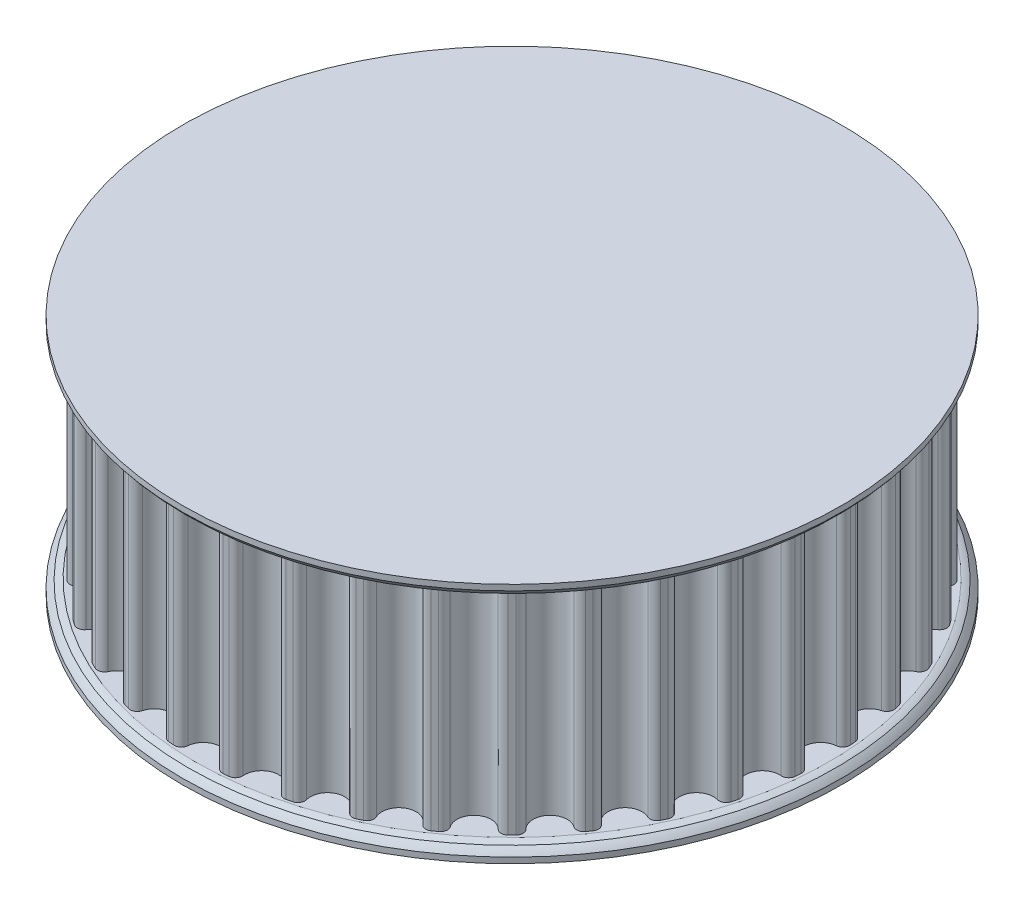
from build123d import *

# Parameters (mm, degrees)
SKETCH1_R               = 28.076389218
TOOTHOD_DEPTH           = 9.525
TOOTHPROFILE_DEPTH      = 45.039411475
TOOTHPATTERN_COUNT      = 36
LARGE_TOOTH_COUNT_DEPTH = 0.4


with BuildPart() as part:
    # Sketch1 → ToothOD (new, symmetric)
    with BuildSketch(Plane(origin=(0, 0, 0), x_dir=(1, 0, 0), z_dir=(0, 1, 0))):
        Circle(SKETCH1_R)
    extrude(amount=TOOTHOD_DEPTH, both=True)

    # Sketch2 → ToothProfile (cut, through all)
    with BuildSketch(Plane(origin=(0, 9.525, 0), x_dir=(1, 0, 0), z_dir=(0, 1, 0))):
        with BuildLine():
            ThreePointArc((-1.519425396, 27.411114635), (0, 26.016389218), (1.519425396, 27.411114635))
            ThreePointArc((1.519425396, 27.411114635), (1.741386688, 27.84115848), (2.201904348, 27.98991334))
            ThreePointArc((2.201904348, 27.98991334), (0, 28.076389218), (-2.201904348, 27.98991334))
            ThreePointArc((-2.201904348, 27.98991334), (-1.741386688, 27.84115848), (-1.519425396, 27.411114635))
        make_face()
    toothprofile = extrude(amount=-TOOTHPROFILE_DEPTH, mode=Mode.SUBTRACT)

    # ToothPattern: ToothProfile ×36 about axis
    toothpattern_axis = Axis((0, 9.525, 0), (0, -1, 0))
    for i in range(1, TOOTHPATTERN_COUNT):
        add(toothprofile.rotate(toothpattern_axis, i * 360 / TOOTHPATTERN_COUNT), mode=Mode.SUBTRACT)

    # Sketch4 → Flange (revolve)
    with BuildSketch(Plane.XY):
        with BuildLine():
            Line((0, -9.525), (28.330389218, -9.525))
            ThreePointArc((28.330389218, -9.525), (28.622194325, -9.609570012), (28.901889218, -9.7282))
            ThreePointArc((28.901889218, -9.7282), (29.172412574, -9.992578767), (29.409889218, -10.287))
            Line((29.409889218, -10.287), (29.409889218, -10.795))
            Line((29.409889218, -10.795), (0, -10.795))
            Line((0, -10.795), (0, -9.525))
        make_face()
        with BuildLine():
            Line((29.409889218, 10.795), (29.409889218, 10.287))
            ThreePointArc((29.409889218, 10.287), (29.172412574, 9.992578767), (28.901889218, 9.7282))
            ThreePointArc((28.901889218, 9.7282), (28.622194325, 9.609570012), (28.330389218, 9.525))
            Line((28.330389218, 9.525), (0, 9.525))
            Line((0, 9.525), (0, 10.795))
            Line((0, 10.795), (29.409889218, 10.795))
        make_face()
    revolve(axis=Axis((0, 12.09802, 0), (0, -1, 0)))

    # Sketch9 → Large Tooth Count (cut)
    # profile 1 of 2: a face of its own
    with BuildSketch(Plane(origin=(0, -10.795, 0), x_dir=(1, 0, 0), z_dir=(0, 1, 0))):
        with BuildLine():
            add(Edge.make_bspline(
                [(-2.884035079, 25.927679637), (-2.831676012, 25.935237516), (-2.730252931, 25.949877644), (-2.58669487, 25.993768546), (-2.458259474, 26.056460669), (-2.362230068, 26.121449448), (-2.296426388, 26.182481156), (-2.253636382, 26.230682319), (-2.219715568, 26.283045088), (-2.192664524, 26.337867987), (-2.172518049, 26.395647847), (-2.16104916, 26.457006077), (-2.157528887, 26.521543707), (-2.160831448, 26.565273661), (-2.162516329, 26.587583543)],
                knots=[0, 0, 0, 0, 1.740208258, 3.370902021, 4.918261647, 6.432614837, 7.167760741, 7.869410875, 8.549014845, 9.215271657, 9.878566188, 10.557109216, 11.263874728, 12, 12, 12, 12], degree=3))
            add(Edge.make_bspline(
                [(-2.162516329, 26.587583543), (-2.168309962, 26.620819923), (-2.179845778, 26.686997533), (-2.227023614, 26.778371141), (-2.295512282, 26.859205997), (-2.382786865, 26.930315039), (-2.488774153, 26.987091558), (-2.611502829, 27.022461704), (-2.748728814, 27.036528925), (-2.843865988, 27.029647292), (-2.893857735, 27.026031199)],
                knots=[0, 0, 0, 0, 0.850222227, 1.69289423, 2.565277518, 3.518771223, 4.526967617, 5.588199176, 6.732670613, 8, 8, 8, 8], degree=3))
            add(Edge.make_bspline(
                [(-2.893857735, 27.026031199), (-2.92519036, 27.022035905), (-2.984912793, 27.014420561), (-3.06865422, 26.996306196), (-3.142935182, 26.975659708), (-3.206800454, 26.948595372), (-3.26197893, 26.917583508), (-3.311151317, 26.88437953), (-3.354161976, 26.847244774), (-3.390652967, 26.804403565), (-3.424514552, 26.756483269), (-3.457551376, 26.701050286), (-3.489243823, 26.636095401), (-3.531981604, 26.541005654), (-3.580933608, 26.420452311), (-3.61983903, 26.324750239), (-3.638593673, 26.278616356)],
                knots=[0, 0, 0, 0, 1.161651273, 2.214198214, 3.149950597, 3.994119379, 4.758968706, 5.475895687, 6.174433602, 6.842065939, 7.541033011, 8.331790609, 9.213421938, 10.19868972, 12.167550603, 14, 14, 14, 14], degree=3))
            add(Edge.make_bspline(
                [(-3.638593673, 26.278616356), (-3.646170923, 26.267210396), (-3.662416976, 26.242755373), (-3.699286097, 26.211670581), (-3.7458031, 26.181540903), (-3.823295482, 26.143666354), (-3.934323504, 26.104723777), (-4.029067247, 26.090429117), (-4.077934298, 26.083056199)],
                knots=[0, 0, 0, 0, 0.496768473, 1.06509974, 1.738921352, 2.514965206, 4.202484234, 6, 6, 6, 6], degree=3))
            add(Edge.make_bspline(
                [(-4.077934298, 26.083056199), (-4.106241545, 26.081416765), (-4.162271571, 26.078171746), (-4.246315592, 26.091797676), (-4.327983067, 26.118868779), (-4.406188329, 26.159098577), (-4.475177937, 26.213899794), (-4.52928993, 26.282443075), (-4.566421022, 26.363353756), (-4.575822274, 26.42230927), (-4.580675704, 26.452745262)],
                knots=[0, 0, 0, 0, 0.977955687, 1.935719217, 2.921872316, 3.943841516, 4.961292039, 5.943408913, 6.938277607, 8, 8, 8, 8], degree=3))
            add(Edge.make_bspline(
                [(-4.580675704, 26.452745262), (-4.582413519, 26.482561203), (-4.585962389, 26.54344967), (-4.569342161, 26.636656979), (-4.541264903, 26.732785573), (-4.495268699, 26.83040787), (-4.435694867, 26.928823925), (-4.361596837, 27.026775064), (-4.273409128, 27.123230795), (-4.171745717, 27.218679007), (-4.055926967, 27.310754187), (-3.924609587, 27.395819511), (-3.778335496, 27.472933754), (-3.618782111, 27.544500161), (-3.446104378, 27.606800017), (-3.261557175, 27.657429942), (-3.066377183, 27.696921381), (-2.932090435, 27.71388289), (-2.863496798, 27.722546824)],
                knots=[0, 0, 0, 0, 0.615610725, 1.25716618, 1.944558692, 2.682656439, 3.480656993, 4.320183036, 5.21778266, 6.180091238, 7.200929026, 8.273026521, 9.410230507, 10.616978748, 11.88637631, 13.201922651, 14.570742808, 16, 16, 16, 16], degree=3))
            add(Edge.make_bspline(
                [(-2.863496798, 27.722546824), (-2.801040711, 27.728416835), (-2.678395584, 27.739943785), (-2.49640722, 27.743130786), (-2.320678615, 27.735535718), (-2.15153077, 27.715743326), (-1.990004054, 27.685726804), (-1.837228499, 27.645074524), (-1.694123755, 27.592969505), (-1.561461133, 27.530738031), (-1.440349165, 27.460043773), (-1.332779968, 27.381116033), (-1.240133777, 27.294123054), (-1.162128365, 27.20002527), (-1.098231171, 27.100427765), (-1.048737485, 26.996434628), (-1.013707029, 26.887969684), (-1.002712281, 26.813426233), (-0.99719211, 26.775999949)],
                knots=[0, 0, 0, 0, 1.300087848, 2.552984794, 3.769882269, 4.944020676, 6.080453409, 7.173156751, 8.21753888, 9.233384416, 10.207027551, 11.120313229, 11.993375782, 12.834812446, 13.647895471, 14.440080806, 15.216806077, 16, 16, 16, 16], degree=3))
            add(Edge.make_bspline(
                [(-0.99719211, 26.775999949), (-0.993812882, 26.727182758), (-0.987177237, 26.631322533), (-1.004634552, 26.489473977), (-1.045608962, 26.354971958), (-1.109148959, 26.228528938), (-1.192177437, 26.109685322), (-1.288558972, 25.995016467), (-1.401207213, 25.886306204), (-1.484747953, 25.820406139), (-1.527615548, 25.786590574)],
                knots=[0, 0, 0, 0, 0.994362274, 1.952586578, 2.889873616, 3.843700919, 4.820142602, 5.834897802, 6.889012454, 8, 8, 8, 8], degree=3))
            add(Edge.make_bspline(
                [(-1.527615548, 25.786590574), (-1.483921418, 25.775154255), (-1.396555963, 25.752287586), (-1.269869753, 25.704220139), (-1.146916588, 25.64685252), (-1.029202007, 25.580442591), (-0.91938119, 25.507042002), (-0.822553539, 25.425818833), (-0.737188336, 25.341090279), (-0.666868788, 25.249668835), (-0.608603087, 25.153985793), (-0.564054797, 25.053770754), (-0.531610115, 24.949157873), (-0.521739913, 24.877155759), (-0.516774923, 24.840936668)],
                knots=[0, 0, 0, 0, 1.102611994, 2.204648487, 3.304091498, 4.414276908, 5.503259953, 6.525433276, 7.497150733, 8.435207282, 9.335505779, 10.227308477, 11.108286225, 12, 12, 12, 12], degree=3))
            add(Edge.make_bspline(
                [(-0.516774923, 24.840936668), (-0.513849553, 24.796897509), (-0.507970285, 24.708389726), (-0.520025694, 24.573539396), (-0.552314148, 24.438624014), (-0.600551992, 24.303302863), (-0.666708579, 24.169788896), (-0.752831196, 24.040500635), (-0.85703851, 23.915169148), (-0.979030067, 23.795516716), (-1.11696605, 23.683104806), (-1.26892908, 23.579025512), (-1.436159631, 23.486862558), (-1.615160774, 23.402428681), (-1.807803446, 23.330956402), (-2.012846829, 23.273645666), (-2.229292721, 23.227229095), (-2.378436582, 23.208381552), (-2.45451711, 23.198767137)],
                knots=[0, 0, 0, 0, 0.755203296, 1.517771262, 2.308060925, 3.125688854, 3.973902143, 4.853469949, 5.780450698, 6.761094328, 7.775587867, 8.82489599, 9.911398865, 11.042734214, 12.212345687, 13.426033089, 14.686980735, 16, 16, 16, 16], degree=3))
            add(Edge.make_bspline(
                [(-2.45451711, 23.198767137), (-2.529467064, 23.19220388), (-2.675913804, 23.179379756), (-2.891552856, 23.180819652), (-3.096988771, 23.197584337), (-3.290571001, 23.234104882), (-3.471477613, 23.282696223), (-3.638085246, 23.342953843), (-3.790760339, 23.410984722), (-3.927790765, 23.489997099), (-4.049817302, 23.57620339), (-4.159730043, 23.665034841), (-4.254493371, 23.758984264), (-4.33468031, 23.854855546), (-4.399311223, 23.949471449), (-4.449248224, 24.039122477), (-4.484450048, 24.122860354), (-4.494054733, 24.178409811), (-4.498522579, 24.204249949)],
                knots=[0, 0, 0, 0, 1.463172344, 2.858932019, 4.190230326, 5.468155111, 6.686213122, 7.831185274, 8.912022685, 9.934231927, 10.903072954, 11.816660061, 12.680756471, 13.494949328, 14.245119792, 14.906085201, 15.491139763, 16, 16, 16, 16], degree=3))
            add(Edge.make_bspline(
                [(-4.498522579, 24.204249949), (-4.50006884, 24.235888809), (-4.503069308, 24.297282978), (-4.481586241, 24.38699047), (-4.437851922, 24.468089505), (-4.373556805, 24.538498443), (-4.295482452, 24.598890857), (-4.205251386, 24.645697399), (-4.105529563, 24.679384387), (-4.034721197, 24.68937406), (-3.998460079, 24.694489793)],
                knots=[0, 0, 0, 0, 0.968847013, 1.880015804, 2.791871975, 3.76951731, 4.785997872, 5.808092692, 6.877519493, 8, 8, 8, 8], degree=3))
            add(Edge.make_bspline(
                [(-3.998460079, 24.694489793), (-3.974965677, 24.696124286), (-3.928273504, 24.699372635), (-3.857918034, 24.696358071), (-3.788663499, 24.681941274), (-3.72190746, 24.66187228), (-3.660623004, 24.638326265), (-3.610751576, 24.610414406), (-3.570604586, 24.582724638), (-3.553553566, 24.558955879), (-3.545724923, 24.548042918)],
                knots=[0, 0, 0, 0, 1.144246022, 2.274045192, 3.408834094, 4.571313731, 5.661908395, 6.587819549, 7.351624938, 8, 8, 8, 8], degree=3))
            add(Edge.make_bspline(
                [(-3.545724923, 24.548042918), (-3.525717534, 24.516338517), (-3.486981127, 24.454955469), (-3.426827037, 24.368177999), (-3.367952935, 24.288591619), (-3.31025799, 24.216158581), (-3.252867741, 24.151625391), (-3.196625893, 24.09431093), (-3.141549456, 24.044015431), (-3.086098207, 24.00117264), (-3.029132295, 23.964469613), (-2.968142217, 23.935197082), (-2.903526836, 23.911812853), (-2.834924299, 23.894962119), (-2.76234196, 23.883546738), (-2.685631209, 23.876913976), (-2.604988049, 23.878339412), (-2.550338462, 23.883050283), (-2.522382735, 23.885460106)],
                knots=[0, 0, 0, 0, 1.377426613, 2.666842544, 3.878731997, 5.014650271, 6.068286915, 7.050530189, 7.964316377, 8.806572593, 9.622789314, 10.449491317, 11.286761617, 12.143592161, 13.04086477, 13.984597961, 14.96903103, 16, 16, 16, 16], degree=3))
            add(Edge.make_bspline(
                [(-2.522382735, 23.885460106), (-2.48591882, 23.89031782), (-2.413424095, 23.89997555), (-2.30770656, 23.928554587), (-2.205442659, 23.966081533), (-2.107348104, 24.013133647), (-2.015616452, 24.069767182), (-1.932744994, 24.135984709), (-1.860983699, 24.211631507), (-1.799880333, 24.294578074), (-1.751840056, 24.384472288), (-1.721723321, 24.480407445), (-1.705817097, 24.580367169), (-1.710812271, 24.647726278), (-1.713353048, 24.681988231)],
                knots=[0, 0, 0, 0, 1.049908396, 2.087346306, 3.120418978, 4.158692913, 5.189839026, 6.193805202, 7.18018844, 8.15984137, 9.129739993, 10.07632233, 11.02152871, 12, 12, 12, 12], degree=3))
            add(Edge.make_bspline(
                [(-1.713353048, 24.681988231), (-1.716728509, 24.707373535), (-1.72330294, 24.756816833), (-1.741262448, 24.828201443), (-1.766570373, 24.894483647), (-1.797350643, 24.956285541), (-1.835686746, 25.01229361), (-1.879720782, 25.063805162), (-1.93076613, 25.110217601), (-1.988211198, 25.151174185), (-2.050863454, 25.187162086), (-2.119201536, 25.216641075), (-2.192557515, 25.239652801), (-2.271137076, 25.25686443), (-2.35485386, 25.266873856), (-2.443416816, 25.272729332), (-2.537151934, 25.270550457), (-2.600994145, 25.264601081), (-2.634003829, 25.261524949)],
                knots=[0, 0, 0, 0, 0.998504333, 1.94480026, 2.863550355, 3.76196865, 4.631558042, 5.504397668, 6.400336112, 7.315557064, 8.25175334, 9.213876129, 10.212785507, 11.246848092, 12.347242561, 13.498948394, 14.706828591, 16, 16, 16, 16], degree=3))
            add(Edge.make_bspline(
                [(-2.634003829, 25.261524949), (-2.647110753, 25.259806662), (-2.677249826, 25.2558555), (-2.727743154, 25.247393336), (-2.789851602, 25.238133973), (-2.858357591, 25.224764209), (-2.926259465, 25.213050885), (-2.984623833, 25.203371247), (-3.029532801, 25.195966439), (-3.054884414, 25.192433136), (-3.065307735, 25.190980418)],
                knots=[0, 0, 0, 0, 0.72581138, 1.668986715, 2.810994872, 4.17347907, 5.500906054, 6.59451956, 7.422136419, 8, 8, 8, 8], degree=3))
            add(Edge.make_bspline(
                [(-3.065307735, 25.190980418), (-3.100997069, 25.188388266), (-3.168834042, 25.183461199), (-3.266382395, 25.188916075), (-3.353595792, 25.208655299), (-3.429989517, 25.240233077), (-3.49472014, 25.284439885), (-3.543698785, 25.341767909), (-3.577809248, 25.410891292), (-3.586061834, 25.461761895), (-3.59037336, 25.488339012)],
                knots=[0, 0, 0, 0, 1.264875514, 2.40422883, 3.441065183, 4.412848931, 5.312378664, 6.185905639, 7.052234581, 8, 8, 8, 8], degree=3))
            add(Edge.make_bspline(
                [(-3.59037336, 25.488339012), (-3.591757012, 25.515300574), (-3.59445853, 25.567941831), (-3.569738036, 25.643733003), (-3.527148692, 25.712640551), (-3.462581343, 25.772093544), (-3.380695764, 25.823860771), (-3.280832698, 25.864426523), (-3.164556894, 25.894507621), (-3.080951892, 25.905691162), (-3.036732735, 25.911606199)],
                knots=[0, 0, 0, 0, 0.827555898, 1.615766271, 2.416902039, 3.307819954, 4.300016632, 5.396284613, 6.62288027, 8, 8, 8, 8], degree=3))
            Line((-3.036732735, 25.911606199), (-2.884035079, 25.927679637))
        make_face()
    # profile 2 of 2: a face of its own
    with BuildSketch(Plane(origin=(0, -10.795, 0), x_dir=(1, 0, 0), z_dir=(0, 1, 0))):
        with BuildLine():
            add(Edge.make_bspline(
                [(2.203501203, 25.74363767), (2.215023059, 25.761764432), (2.238226309, 25.798268946), (2.280235163, 25.848371015), (2.329304488, 25.892938508), (2.382818995, 25.934269908), (2.44211806, 25.970955828), (2.507151625, 26.003043975), (2.577596094, 26.032066064), (2.680955827, 26.062097721), (2.817085193, 26.091442628), (2.987895334, 26.110051601), (3.165887386, 26.11197657), (3.286139857, 26.10044722), (3.347394171, 26.094574389)],
                knots=[0, 0, 0, 0, 0.613444048, 1.235382116, 1.861437296, 2.504597843, 3.165571077, 3.850366405, 4.575455034, 5.339755039, 6.923165713, 8.549326557, 10.242292783, 12, 12, 12, 12], degree=3))
            add(Edge.make_bspline(
                [(3.347394171, 26.094574389), (3.408910985, 26.086136271), (3.529904335, 26.069539895), (3.705512376, 26.026317344), (3.873194952, 25.973025106), (4.030608874, 25.903166275), (4.178411863, 25.823570393), (4.315568354, 25.732717201), (4.440629505, 25.631048558), (4.553095312, 25.518988378), (4.653228281, 25.400314302), (4.737677454, 25.273962675), (4.808287806, 25.142489352), (4.861276433, 25.004812625), (4.899793626, 24.864478788), (4.923639017, 24.722706097), (4.930137615, 24.579932239), (4.922131349, 24.485404829), (4.918126203, 24.438117358)],
                knots=[0, 0, 0, 0, 1.172616085, 2.306340954, 3.412736328, 4.493308033, 5.555437106, 6.581953065, 7.597483961, 8.595811742, 9.578149656, 10.526666918, 11.462710326, 12.392360464, 13.307985237, 14.208664154, 15.103881691, 16, 16, 16, 16], degree=3))
            add(Edge.make_bspline(
                [(4.918126203, 24.438117358), (4.913283884, 24.403799463), (4.903698913, 24.335870016), (4.880346128, 24.236002941), (4.848402725, 24.139729041), (4.811833373, 24.045133486), (4.764220434, 23.955306555), (4.711893931, 23.866929748), (4.650603872, 23.782339153), (4.583190696, 23.700050959), (4.508126206, 23.622866782), (4.427573773, 23.549997653), (4.340735858, 23.48321788), (4.248378213, 23.421293467), (4.150117581, 23.364746112), (4.045097164, 23.315358236), (3.935103639, 23.269317785), (3.819357599, 23.229482624), (3.699264636, 23.195517414), (3.575418743, 23.16892001), (3.44908786, 23.14829036), (3.319692321, 23.134812353), (3.187320688, 23.128868817), (3.052060761, 23.129000207), (2.913728871, 23.134793086), (2.821097626, 23.144592478), (2.774108234, 23.149563451)],
                knots=[0, 0, 0, 0, 0.895354488, 1.772280501, 2.645555456, 3.51543614, 4.389252956, 5.269142703, 6.167795252, 7.085697404, 8.015925239, 8.947297267, 9.890442701, 10.844069236, 11.819139291, 12.816882843, 13.841108761, 14.899288246, 15.97806737, 17.064361734, 18.170866076, 19.284512668, 20.424206853, 21.593396555, 22.779193433, 24, 24, 24, 24], degree=3))
            add(Edge.make_bspline(
                [(2.774108234, 23.149563451), (2.722542, 23.156533406), (2.621103112, 23.170244403), (2.472453755, 23.198589586), (2.330282067, 23.235302408), (2.194485502, 23.279275872), (2.064058675, 23.328994985), (1.940540998, 23.38718065), (1.822495493, 23.451371545), (1.71216861, 23.523926447), (1.607919285, 23.602507082), (1.51159641, 23.688320746), (1.422452188, 23.780495666), (1.342522787, 23.880111831), (1.268508351, 23.985029682), (1.202555889, 24.09671487), (1.144182503, 24.215154295), (1.094342888, 24.340348773), (1.052574841, 24.471705632), (1.018378164, 24.608527587), (0.99365411, 24.751229596), (0.97682342, 24.899714498), (0.967740835, 25.054139119), (0.968289696, 25.214200793), (0.976045921, 25.379909898), (0.987623191, 25.49186448), (0.993528546, 25.548970483)],
                knots=[0, 0, 0, 0, 1.101945886, 2.167700797, 3.202848405, 4.209638408, 5.189542752, 6.156895346, 7.099254405, 8.032970507, 8.950867952, 9.861811528, 10.762444273, 11.663319684, 12.564018617, 13.479770351, 14.407337055, 15.357905209, 16.330829118, 17.324667215, 18.342449987, 19.39577065, 20.488208315, 21.616650366, 22.784296571, 24, 24, 24, 24], degree=3))
            add(Edge.make_bspline(
                [(0.993528546, 25.548970483), (1.005836875, 25.640287129), (1.029888937, 25.818731639), (1.08839206, 26.076412442), (1.163187311, 26.317453911), (1.253990965, 26.541108792), (1.359947349, 26.746207465), (1.480767272, 26.931440077), (1.615839963, 27.095911576), (1.765421979, 27.239136713), (1.92794469, 27.362125926), (2.102836497, 27.465396304), (2.290510971, 27.548213502), (2.4904232, 27.610283502), (2.7015796, 27.65356224), (2.923913686, 27.673848573), (3.15645661, 27.676544073), (3.314133238, 27.661425106), (3.394721515, 27.653697826)],
                knots=[0, 0, 0, 0, 1.218454138, 2.381016589, 3.490681872, 4.553872008, 5.570071317, 6.539888876, 7.474112584, 8.379228779, 9.273080193, 10.164499825, 11.06006687, 11.980403877, 12.928711533, 13.9058874, 14.929702326, 16, 16, 16, 16], degree=3))
            add(Edge.make_bspline(
                [(3.394721515, 27.653697826), (3.475678098, 27.642470068), (3.633345543, 27.620603385), (3.859230435, 27.562432678), (4.069110164, 27.487991796), (4.259602511, 27.394424968), (4.429437608, 27.289460678), (4.577509375, 27.178595849), (4.699692603, 27.059206778), (4.795175882, 26.934140467), (4.86650389, 26.809957838), (4.915651451, 26.690786797), (4.941471869, 26.576668725), (4.938364917, 26.503053151), (4.936878546, 26.467835326)],
                knots=[0, 0, 0, 0, 1.390540602, 2.708155126, 3.963331081, 5.175889778, 6.313652854, 7.358653984, 8.319042404, 9.212016446, 10.029166285, 10.750016722, 11.402005716, 12, 12, 12, 12], degree=3))
            add(Edge.make_bspline(
                [(4.936878546, 26.467835326), (4.932303094, 26.446322496), (4.922878335, 26.402009235), (4.886588583, 26.340170813), (4.833652068, 26.282375249), (4.766401106, 26.228055496), (4.684485563, 26.182741236), (4.589709233, 26.155803836), (4.485508404, 26.143617333), (4.413597269, 26.149532487), (4.376094171, 26.152617358)],
                knots=[0, 0, 0, 0, 0.743286091, 1.531059836, 2.39777145, 3.397524334, 4.456444525, 5.553923108, 6.724321896, 8, 8, 8, 8], degree=3))
            add(Edge.make_bspline(
                [(4.376094171, 26.152617358), (4.348257771, 26.156954978), (4.293230914, 26.165529563), (4.213777719, 26.190977725), (4.138837408, 26.227319354), (4.068868076, 26.273170891), (4.006272651, 26.328256437), (3.953913414, 26.391523507), (3.911733627, 26.461899257), (3.893354508, 26.513301602), (3.88406839, 26.539272826)],
                knots=[0, 0, 0, 0, 1.020618409, 2.017553351, 3.012206103, 4.033224094, 5.042705437, 6.024088088, 7.001663227, 8, 8, 8, 8], degree=3))
            add(Edge.make_bspline(
                [(3.88406839, 26.539272826), (3.873324261, 26.566768676), (3.851801531, 26.621848595), (3.803453662, 26.697792733), (3.741284685, 26.766009244), (3.668466071, 26.828401454), (3.584723299, 26.881889352), (3.491135409, 26.924025798), (3.389259211, 26.955975114), (3.317244522, 26.966227425), (3.280421515, 26.971469701)],
                knots=[0, 0, 0, 0, 0.903240237, 1.809378505, 2.739763284, 3.723375079, 4.740762313, 5.773657041, 6.861612198, 8, 8, 8, 8], degree=3))
            add(Edge.make_bspline(
                [(3.280421515, 26.971469701), (3.253939005, 26.973653223), (3.199769885, 26.978119545), (3.116809272, 26.971608421), (3.031034519, 26.957769479), (2.944289309, 26.93205381), (2.856633168, 26.898900971), (2.77158228, 26.853814591), (2.68942069, 26.797839573), (2.63855031, 26.75381981), (2.61248089, 26.731261108)],
                knots=[0, 0, 0, 0, 0.870812824, 1.781219528, 2.722345853, 3.718018339, 4.744833727, 5.793581382, 6.869281978, 8, 8, 8, 8], degree=3))
            add(Edge.make_bspline(
                [(2.61248089, 26.731261108), (2.589391168, 26.708398273), (2.541069459, 26.660551389), (2.480925295, 26.57187818), (2.422544372, 26.470945028), (2.369062024, 26.354582885), (2.320113191, 26.223278016), (2.277382508, 26.076397025), (2.236588725, 25.915414), (2.214820947, 25.802404964), (2.203501203, 25.74363767)],
                knots=[0, 0, 0, 0, 0.717079135, 1.5006889, 2.358837939, 3.295387785, 4.328582991, 5.455330196, 6.676713245, 8, 8, 8, 8], degree=3))
        make_face()
        with BuildLine():
            add(Edge.make_bspline(
                [(2.872334796, 23.832684545), (2.900886719, 23.830085583), (2.957026674, 23.824975396), (3.040391895, 23.826257068), (3.120980224, 23.833588017), (3.198102034, 23.85059927), (3.273002242, 23.871845996), (3.343433196, 23.904340305), (3.412143437, 23.941561906), (3.476696777, 23.986948321), (3.536587254, 24.038662562), (3.590397128, 24.096167161), (3.638169398, 24.158736518), (3.67801245, 24.227171204), (3.712826354, 24.300031381), (3.738813154, 24.378824871), (3.760027422, 24.462636469), (3.768231434, 24.520761987), (3.772447296, 24.55063142)],
                knots=[0, 0, 0, 0, 1.063199481, 2.090506127, 3.089574568, 4.060086087, 5.01756152, 5.97197384, 6.931104374, 7.914727289, 8.893563084, 9.862564862, 10.832384707, 11.807974355, 12.796237756, 13.823188049, 14.88138394, 16, 16, 16, 16], degree=3))
            add(Edge.make_bspline(
                [(3.772447296, 24.55063142), (3.775716515, 24.590475797), (3.782083361, 24.668073225), (3.776622421, 24.782163646), (3.753588864, 24.888714689), (3.717849966, 24.987590213), (3.669616277, 25.078268975), (3.608933108, 25.159690372), (3.536754778, 25.231507698), (3.454303014, 25.293979024), (3.363629978, 25.346301035), (3.265998601, 25.387994136), (3.162067343, 25.417512207), (3.090074131, 25.428308748), (3.053607453, 25.433777514)],
                knots=[0, 0, 0, 0, 1.123188771, 2.187424354, 3.19665849, 4.176003339, 5.134283769, 6.07307922, 7.019709396, 7.986970209, 8.972905249, 9.955105337, 10.964200728, 12, 12, 12, 12], degree=3))
            add(Edge.make_bspline(
                [(3.053607453, 25.433777514), (3.021481818, 25.436648256), (2.957559994, 25.442360302), (2.861144489, 25.436895873), (2.764892507, 25.423121067), (2.670216466, 25.397173284), (2.578635289, 25.360939644), (2.493036226, 25.312175004), (2.413968052, 25.251625787), (2.341585516, 25.180724548), (2.279199139, 25.098159549), (2.230642215, 25.00364339), (2.195370094, 24.898191406), (2.183647808, 24.823230622), (2.177605109, 24.784589233)],
                knots=[0, 0, 0, 0, 0.951599433, 1.893440289, 2.844714694, 3.81947098, 4.7860635, 5.746879999, 6.719373238, 7.72038541, 8.731540898, 9.761896176, 10.846284194, 12, 12, 12, 12], degree=3))
            add(Edge.make_bspline(
                [(2.177605109, 24.784589233), (2.174736783, 24.753066433), (2.169143181, 24.691592936), (2.169089268, 24.600452135), (2.176929417, 24.513130247), (2.192893435, 24.429591397), (2.217393581, 24.35005038), (2.249456039, 24.274375283), (2.289061918, 24.202137628), (2.336277013, 24.134652741), (2.389551715, 24.072780664), (2.446850289, 24.016692612), (2.508587051, 23.968705582), (2.573697058, 23.927088001), (2.642421195, 23.891639166), (2.716026163, 23.865774142), (2.792535768, 23.844143982), (2.845422004, 23.836549322), (2.872334796, 23.832684545)],
                knots=[0, 0, 0, 0, 1.152285992, 2.247105266, 3.313875461, 4.340684999, 5.338476187, 6.339089653, 7.32878132, 8.333145488, 9.332525188, 10.298423288, 11.248189752, 12.174342225, 13.109961579, 14.056443896, 15.010961536, 16, 16, 16, 16], degree=3))
        make_face(mode=Mode.SUBTRACT)
    large_tooth_count = extrude(amount=LARGE_TOOTH_COUNT_DEPTH, mode=Mode.SUBTRACT)

    # Mirror1: Large Tooth Count across plane
    add(large_tooth_count.mirror(Plane.XY), mode=Mode.SUBTRACT)


solid = part.part
